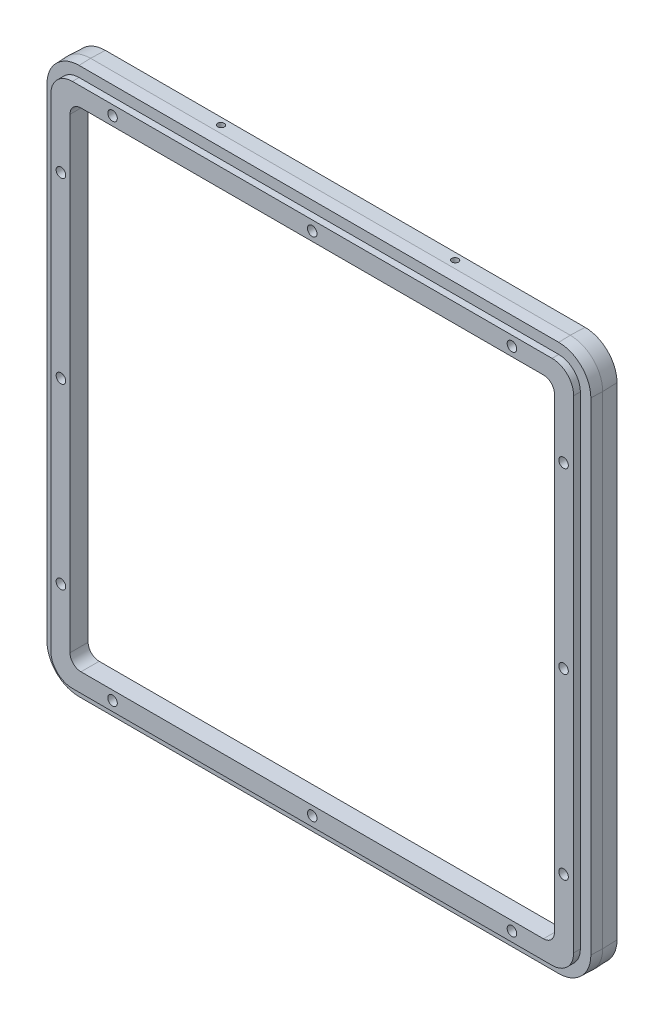
from build123d import *

# Parameters (mm, degrees)
BOSS_EXTRUDE1_DEPTH           = 6.096
BOSS_EXTRUDE1_TAPER           = 2
BOSS_EXTRUDE1_OTHER_WAY_DEPTH = 7.874
BOSS_EXTRUDE1_OTHER_WAY_TAPER = 2
CUT_EXTRUDE1_DEPTH            = 206.440312742
CUT_EXTRUDE1_DEPTH_BACK       = 206.440312742
BOSS_EXTRUDE2_START           = 6.096
BOSS_EXTRUDE2_DEPTH           = 3.556
CUT_EXTRUDE2_DEPTH            = 206.516138846
CUT_EXTRUDE2_DEPTH_BACK       = 206.516138846
SKETCH4_4_R                   = 2.54
CUT_EXTRUDE5_START            = -7.874
CUT_EXTRUDE5_DEPTH            = 7.874
SKETCH6_W                     = 12.7
SKETCH6_H                     = 5.08
SKETCH6_R                     = 1.778
CUT_EXTRUDE6_DEPTH            = 160.02
SKETCH6_3_R                   = 1.778
CUT_EXTRUDE7_DEPTH            = 160.02


with BuildPart() as part:
    # Sketch1 → Boss-Extrude1 (new body)
    with BuildSketch(Plane.XY):
        with BuildLine():
            Line((-127.508, -145.542), (127.508, -145.542))
            ThreePointArc((127.508, -145.542), (139.721148325, -140.483148325), (144.78, -128.27))
            Line((144.78, -128.27), (144.78, 128.27))
            ThreePointArc((144.78, 128.27), (139.721148325, 140.483148325), (127.508, 145.542))
            Line((127.508, 145.542), (-127.508, 145.542))
            ThreePointArc((-127.508, 145.542), (-139.721148325, 140.483148325), (-144.78, 128.27))
            Line((-144.78, 128.27), (-144.78, -128.27))
            ThreePointArc((-144.78, -128.27), (-139.721148325, -140.483148325), (-127.508, -145.542))
        make_face()
    extrude(amount=BOSS_EXTRUDE1_DEPTH, taper=BOSS_EXTRUDE1_TAPER)

    # Sketch1 → Boss-Extrude1 other way (add)
    with BuildSketch(Plane.XY):
        with BuildLine():
            Line((-127.508, -145.542), (127.508, -145.542))
            ThreePointArc((127.508, -145.542), (139.721148325, -140.483148325), (144.78, -128.27))
            Line((144.78, -128.27), (144.78, 128.27))
            ThreePointArc((144.78, 128.27), (139.721148325, 140.483148325), (127.508, 145.542))
            Line((127.508, 145.542), (-127.508, 145.542))
            ThreePointArc((-127.508, 145.542), (-139.721148325, 140.483148325), (-144.78, 128.27))
            Line((-144.78, 128.27), (-144.78, -128.27))
            ThreePointArc((-144.78, -128.27), (-139.721148325, -140.483148325), (-127.508, -145.542))
        make_face()
    extrude(amount=-BOSS_EXTRUDE1_OTHER_WAY_DEPTH, taper=BOSS_EXTRUDE1_OTHER_WAY_TAPER)

    # Sketch4 → Cut-Extrude1 (cut, two sides: drawn at the far end of the back side and taken through both)
    with BuildSketch(Plane.XY.offset(-CUT_EXTRUDE1_DEPTH_BACK)):
        with BuildLine():
            ThreePointArc((-128.778, 123.952), (-127.066917816, 128.082917816), (-122.936, 129.794))
            Line((-122.936, 129.794), (122.936, 129.794))
            ThreePointArc((122.936, 129.794), (127.066917816, 128.082917816), (128.778, 123.952))
            Line((128.778, 123.952), (128.778, -123.952))
            ThreePointArc((128.778, -123.952), (127.066917816, -128.082917816), (122.936, -129.794))
            Line((122.936, -129.794), (-122.936, -129.794))
            ThreePointArc((-122.936, -129.794), (-127.066917816, -128.082917816), (-128.778, -123.952))
            Line((-128.778, -123.952), (-128.778, 123.952))
        make_face()
    extrude(amount=CUT_EXTRUDE1_DEPTH + CUT_EXTRUDE1_DEPTH_BACK, mode=Mode.SUBTRACT)

    # Sketch5 → Boss-Extrude2 (add)
    with BuildSketch(Plane.XY.offset(BOSS_EXTRUDE2_START)):
        with BuildLine():
            Line((-138.979122989, 128.27), (-138.979122989, -128.27))
            ThreePointArc((-138.979122989, -128.27), (-135.619308853, -136.381308853), (-127.508, -139.741122989))
            Line((-127.508, -139.741122989), (127.508, -139.741122989))
            ThreePointArc((127.508, -139.741122989), (135.619308853, -136.381308853), (138.979122989, -128.27))
            Line((138.979122989, -128.27), (138.979122989, 128.27))
            ThreePointArc((138.979122989, 128.27), (135.619308853, 136.381308853), (127.508, 139.741122989))
            Line((127.508, 139.741122989), (-127.508, 139.741122989))
            ThreePointArc((-127.508, 139.741122989), (-135.619308853, 136.381308853), (-138.979122989, 128.27))
        make_face()
        with BuildLine():
            ThreePointArc((-122.936, 129.794), (-127.066917816, 128.082917816), (-128.778, 123.952))
            Line((-128.778, 123.952), (-128.778, -123.952))
            ThreePointArc((-128.778, -123.952), (-127.066917816, -128.082917816), (-122.936, -129.794))
            Line((-122.936, -129.794), (122.936, -129.794))
            ThreePointArc((122.936, -129.794), (127.066917816, -128.082917816), (128.778, -123.952))
            Line((128.778, -123.952), (128.778, 123.952))
            ThreePointArc((128.778, 123.952), (127.066917816, 128.082917816), (122.936, 129.794))
            Line((122.936, 129.794), (-122.936, 129.794))
        make_face(mode=Mode.SUBTRACT)
    extrude(amount=BOSS_EXTRUDE2_DEPTH)

    # Sketch4<4> → Cut-Extrude2 (cut, two sides: drawn at the far end of the back side and taken through both)
    with BuildSketch(Plane.XY.offset(-CUT_EXTRUDE2_DEPTH_BACK)):
        with Locations((-106.172, -134.62)):
            Circle(SKETCH4_4_R)
        with Locations((-133.604, -94.742)):
            Circle(SKETCH4_4_R)
        with Locations(Location((133.604, 0, 0), (0, 0, 180))):
            Circle(SKETCH4_4_R)
        with Locations(Location((133.604, -94.742, 0), (0, 0, 180))):
            Circle(SKETCH4_4_R)
        with Locations(Location((106.172, -134.62, 0), (0, 0, 180))):
            Circle(SKETCH4_4_R)
        with Locations((106.172, 134.62)):
            Circle(SKETCH4_4_R)
        with Locations((133.604, 94.742)):
            Circle(SKETCH4_4_R)
        with Locations(Location((-133.604, 94.742, 0), (0, 0, 180))):
            Circle(SKETCH4_4_R)
        with Locations(Location((-106.172, 134.62, 0), (0, 0, 180))):
            Circle(SKETCH4_4_R)
        with Locations((0, 134.62)):
            Circle(SKETCH4_4_R)
        with Locations((0, -134.62)):
            Circle(SKETCH4_4_R)
        with Locations((-133.604, 0)):
            Circle(SKETCH4_4_R)
        with BuildLine():
            Line((-122.936, -129.794), (122.936, -129.794))
            ThreePointArc((122.936, -129.794), (127.066917816, -128.082917816), (128.778, -123.952))
            Line((128.778, -123.952), (128.778, 123.952))
            ThreePointArc((128.778, 123.952), (127.066917816, 128.082917816), (122.936, 129.794))
            Line((122.936, 129.794), (-122.936, 129.794))
            ThreePointArc((-122.936, 129.794), (-127.066917816, 128.082917816), (-128.778, 123.952))
            Line((-128.778, 123.952), (-128.778, -123.952))
            ThreePointArc((-128.778, -123.952), (-127.066917816, -128.082917816), (-122.936, -129.794))
        make_face()
    extrude(amount=CUT_EXTRUDE2_DEPTH + CUT_EXTRUDE2_DEPTH_BACK, mode=Mode.SUBTRACT)

    # Sketch5<4> → Cut-Extrude5 (cut)
    with BuildSketch(Plane.XY.offset(CUT_EXTRUDE5_START)):
        with BuildLine():
            Line((-138.979122989, 128.27), (-138.979122989, -128.27))
            ThreePointArc((-138.979122989, -128.27), (-135.619308853, -136.381308853), (-127.508, -139.741122989))
            Line((-127.508, -139.741122989), (127.508, -139.741122989))
            ThreePointArc((127.508, -139.741122989), (135.619308853, -136.381308853), (138.979122989, -128.27))
            Line((138.979122989, -128.27), (138.979122989, 128.27))
            ThreePointArc((138.979122989, 128.27), (135.619308853, 136.381308853), (127.508, 139.741122989))
            Line((127.508, 139.741122989), (-127.508, 139.741122989))
            ThreePointArc((-127.508, 139.741122989), (-135.619308853, 136.381308853), (-138.979122989, 128.27))
        make_face()
        with BuildLine():
            ThreePointArc((-122.936, 129.794), (-127.066917816, 128.082917816), (-128.778, 123.952))
            Line((-128.778, 123.952), (-128.778, -123.952))
            ThreePointArc((-128.778, -123.952), (-127.066917816, -128.082917816), (-122.936, -129.794))
            Line((-122.936, -129.794), (122.936, -129.794))
            ThreePointArc((122.936, -129.794), (127.066917816, -128.082917816), (128.778, -123.952))
            Line((128.778, -123.952), (128.778, 123.952))
            ThreePointArc((128.778, 123.952), (127.066917816, 128.082917816), (122.936, 129.794))
            Line((122.936, 129.794), (-122.936, 129.794))
        make_face(mode=Mode.SUBTRACT)
    extrude(amount=CUT_EXTRUDE5_DEPTH, mode=Mode.SUBTRACT)

    # Sketch6 → Cut-Extrude6 (cut)
    with BuildSketch(Plane(origin=(0, 0, 0), x_dir=(1, 0, 0), z_dir=(0, 1, 0))):
        with Locations((-50.8, 5.334)):
            Rectangle(SKETCH6_W, SKETCH6_H)
        with Locations((50.8, 5.334)):
            Rectangle(SKETCH6_W, SKETCH6_H)
        with Locations((-72.39, 4.064)):
            Circle(SKETCH6_R)
        with Locations((72.39, 4.064)):
            Circle(SKETCH6_R)
    extrude(amount=-CUT_EXTRUDE6_DEPTH, mode=Mode.SUBTRACT)

    # Sketch6<3> → Cut-Extrude7 (cut)
    with BuildSketch(Plane(origin=(0, 0, 0), x_dir=(1, 0, 0), z_dir=(0, 1, 0))):
        with Locations(Location((62.23, 4.064, 0), (0, 0, 90))):
            Circle(SKETCH6_3_R)
        with Locations(Location((-62.23, 4.064, 0), (0, 0, 90))):
            Circle(SKETCH6_3_R)
    extrude(amount=CUT_EXTRUDE7_DEPTH, mode=Mode.SUBTRACT)


solid = part.part
